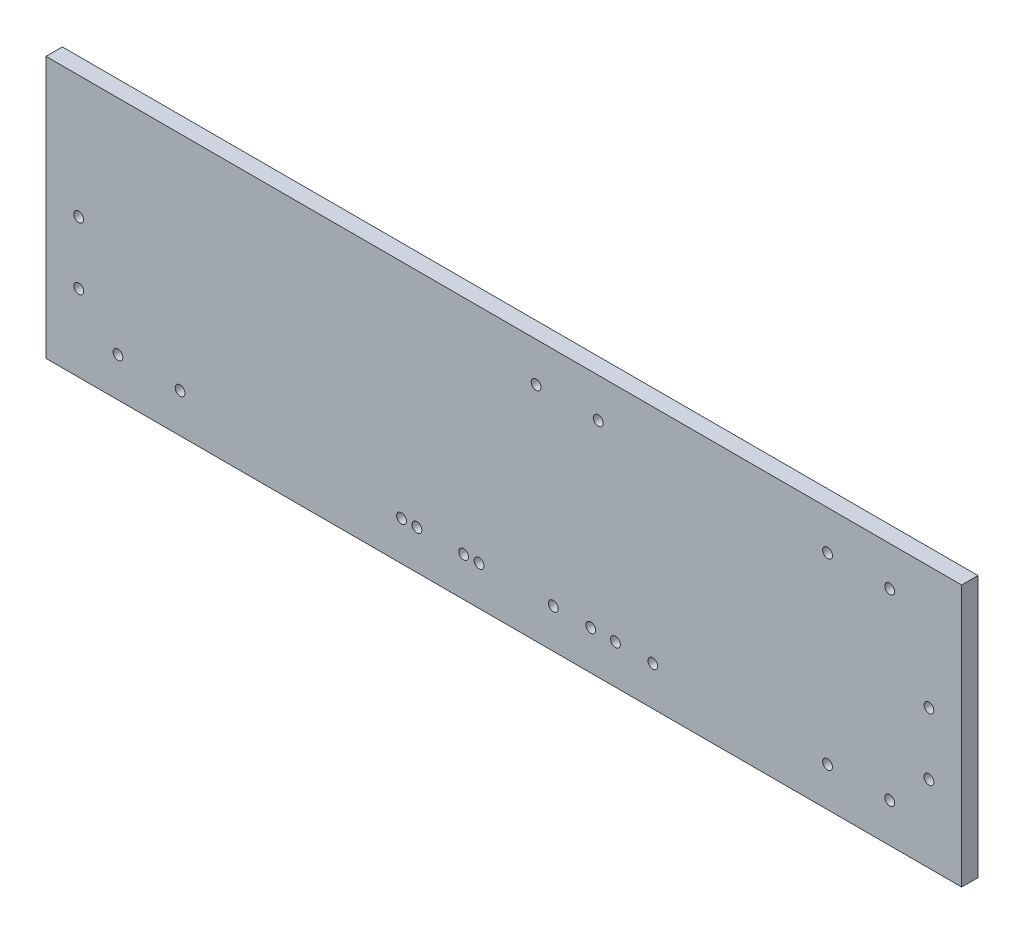
from build123d import *

# Parameters (mm, degrees)
SKETCH1_W                = 355.6
SKETCH1_H                = 101.6
BOSS_EXTRUDE1_DEPTH      = 6.35
SKETCH2_R                = 1.905
CUT_EXTRUDE1_DEPTH       = 6.35
SKETCH3_R                = 1.905
CUT_EXTRUDE2_DEPTH       = 6.35
LPATTERN_BS_RIGHT_COUNT  = 2
LPATTERN_BS_RIGHT_PITCH  = 110.127034
LPATTERN_UA_ANGLED_COUNT = 2
LPATTERN_UA_ANGLED_PITCH = 116.10467
SKETCH4_R                = 1.905
CUT_EXTRUDE4_DEPTH       = 6.35
LPATTERN_UA_LEFT_COUNT   = 2
LPATTERN_UA_LEFT_PITCH   = 91.984322
LPATTERN4_UA_RIGHT_COUNT = 2
LPATTERN4_UA_RIGHT_PITCH = 106.498644
SKETCH5_R                = 1.905
CUT_EXTRUDE5_DEPTH       = 6.35
LPATTERN5_COUNT          = 2
LPATTERN5_PITCH          = 113.199418


with BuildPart() as part:
    # Sketch1 → Boss-Extrude1 (new body)
    with BuildSketch(Plane.XY):
        with Locations((177.8, 50.8)):
            Rectangle(SKETCH1_W, SKETCH1_H)
    extrude(amount=BOSS_EXTRUDE1_DEPTH)

    # Sketch2 → Cut-Extrude1 (cut)
    with BuildSketch(Plane.XY.offset(6.35)):
        with Locations((27.94, 15.24)):
            Circle(SKETCH2_R)
        with Locations((52.07, 15.24)):
            Circle(SKETCH2_R)
    cut_extrude1 = extrude(amount=-CUT_EXTRUDE1_DEPTH, mode=Mode.SUBTRACT)

    # Sketch3 → Cut-Extrude2 (cut)
    with BuildSketch(Plane.XY.offset(6.35)):
        with Locations((12.7, 29.845)):
            Circle(SKETCH3_R)
        with Locations((12.7, 53.975)):
            Circle(SKETCH3_R)
        with Locations(Location((342.9, 29.845, 0), (0, 0, 180))):
            Circle(SKETCH3_R)
        with Locations(Location((342.9, 53.975, 0), (0, 0, 180))):
            Circle(SKETCH3_R)
    extrude(amount=-CUT_EXTRUDE2_DEPTH, mode=Mode.SUBTRACT)

    # LPattern-bs-right: Cut-Extrude1 ×2
    with Locations(*[(i * LPATTERN_BS_RIGHT_PITCH, 0, 0) for i in range(1, LPATTERN_BS_RIGHT_COUNT)]):
        add(cut_extrude1, mode=Mode.SUBTRACT)

    # LPattern-ua-angled: Cut-Extrude1 ×2
    with Locations(*[(i * LPATTERN_UA_ANGLED_PITCH, 0, 0) for i in range(1, LPATTERN_UA_ANGLED_COUNT)]):
        add(cut_extrude1, mode=Mode.SUBTRACT)

    # Sketch4 → Cut-Extrude4 (cut)
    with BuildSketch(Plane.XY.offset(6.35)):
        with Locations((327.66, 15.24)):
            Circle(SKETCH4_R)
        with Locations((303.53, 15.24)):
            Circle(SKETCH4_R)
    cut_extrude4 = extrude(amount=-CUT_EXTRUDE4_DEPTH, mode=Mode.SUBTRACT)

    # LPattern-ua-left: Cut-Extrude4 ×2
    with Locations(*[(-i * LPATTERN_UA_LEFT_PITCH, 0, 0) for i in range(1, LPATTERN_UA_LEFT_COUNT)]):
        add(cut_extrude4, mode=Mode.SUBTRACT)

    # LPattern4-ua-right: Cut-Extrude4 ×2
    with Locations(*[(-i * LPATTERN4_UA_RIGHT_PITCH, 0, 0) for i in range(1, LPATTERN4_UA_RIGHT_COUNT)]):
        add(cut_extrude4, mode=Mode.SUBTRACT)

    # Sketch5 → Cut-Extrude5 (cut)
    with BuildSketch(Plane.XY.offset(6.35)):
        with Locations((327.66, 86.36)):
            Circle(SKETCH5_R)
        with Locations((303.53, 86.36)):
            Circle(SKETCH5_R)
    cut_extrude5 = extrude(amount=-CUT_EXTRUDE5_DEPTH, mode=Mode.SUBTRACT)

    # LPattern5: Cut-Extrude5 ×2
    with Locations(*[(-i * LPATTERN5_PITCH, 0, 0) for i in range(1, LPATTERN5_COUNT)]):
        add(cut_extrude5, mode=Mode.SUBTRACT)


solid = part.part
